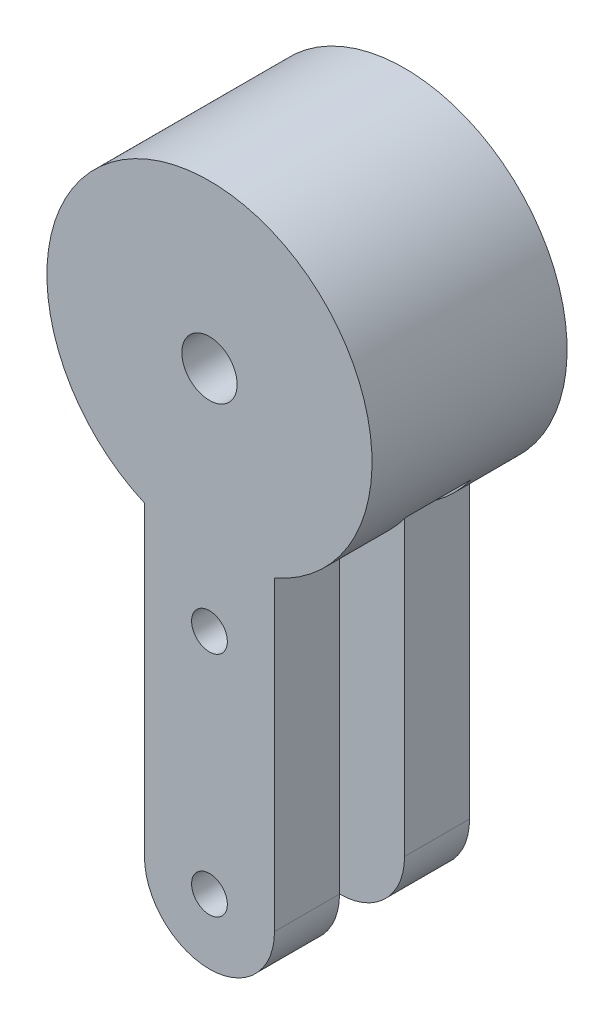
from build123d import *
from build123d.topology import SkipClean

# Parameters (mm, degrees)
SKETCH2_R           = 4.25
SKETCH2_R_2         = 2.75
BOSS_EXTRUDE1_DEPTH = 10
BOSS_EXTRUDE2_START = 10.4
BOSS_EXTRUDE2_DEPTH = 10.4
BOSS_EXTRUDE3_START = 10.4
SKETCH4_R           = 2.75
SKETCH4_R_2         = 4.25
BOSS_EXTRUDE3_DEPTH = 10.4
SKETCH5_R           = 4.25
BOSS_EXTRUDE4_DEPTH = 0.4
CUT_EXTRUDE2_DEPTH  = 0.4
CUT_EXTRUDE3_DEPTH  = 0.4


with BuildPart() as part:
    # Sketch2 → Boss-Extrude1 (new body)
    with BuildSketch(Plane.XY):
        with BuildLine():
            Line((-10, 237.087121525), (-10, 190))
            ThreePointArc((-10, 190), (0, 180), (10, 190))
            Line((10, 190), (10, 237.087121525))
            ThreePointArc((10, 237.087121525), (0, 285), (-10, 237.087121525))
        make_face()
        with Locations((0, 260)):
            Circle(SKETCH2_R, mode=Mode.SUBTRACT)
        with Locations((0, 225)):
            Circle(SKETCH2_R_2, mode=Mode.SUBTRACT)
        with Locations((0, 190)):
            Circle(SKETCH2_R_2, mode=Mode.SUBTRACT)
    extrude(amount=BOSS_EXTRUDE1_DEPTH)

    # Sketch3 → Boss-Extrude2 (add)
    with BuildSketch(Plane(origin=(0, 0, 0), x_dir=(-1, 0, 0), z_dir=(0, 0, -1)).offset(BOSS_EXTRUDE2_START)):
        with BuildLine():
            Line((-20.2, 245.270437888), (-20.2, 260))
            ThreePointArc((-20.2, 260), (0, 280.2), (20.2, 260))
            Line((20.2, 260), (20.2, 245.270437888))
            ThreePointArc((20.2, 245.270437888), (23.769728648, 252.254033308), (25, 260))
            ThreePointArc((25, 260), (-7.745966692, 283.769728648), (-20.2, 245.270437888))
        make_face()
    extrude(amount=-BOSS_EXTRUDE2_DEPTH)

    # Sketch4 → Boss-Extrude3 (add)
    with BuildSketch(Plane(origin=(0, 0, -10.4), x_dir=(-1, 0, 0), z_dir=(0, 0, -1)).offset(BOSS_EXTRUDE3_START)):
        with BuildLine():
            Line((-10, 237.087121525), (-10, 190))
            ThreePointArc((-10, 190), (0, 180), (10, 190))
            Line((10, 190), (10, 237.087121525))
            ThreePointArc((10, 237.087121525), (0, 285), (-10, 237.087121525))
        make_face()
        with Locations((0, 190)):
            Circle(SKETCH4_R, mode=Mode.SUBTRACT)
        with Locations((0, 225)):
            Circle(SKETCH4_R, mode=Mode.SUBTRACT)
        with Locations((0, 260)):
            Circle(SKETCH4_R_2, mode=Mode.SUBTRACT)
    extrude(amount=-BOSS_EXTRUDE3_DEPTH)

    # Sketch5 → Boss-Extrude4 (add)
    with SkipClean():  # the faces are left unmerged after this step: merging them gives an invalid solid
        with BuildSketch(Plane.XY.offset(-10.4)):
            with BuildLine():
                Line((-20.2, 260), (-20.2, 245.270437888))
                ThreePointArc((-20.2, 245.270437888), (-15.644541114, 240.500042735), (-10, 237.087121525))
                Line((-10, 237.087121525), (-10, 190))
                ThreePointArc((-10, 190), (0, 180), (10, 190))
                Line((10, 190), (10, 237.087121525))
                ThreePointArc((10, 237.087121525), (15.644541114, 240.500042735), (20.2, 245.270437888))
                Line((20.2, 245.270437888), (20.2, 260))
                ThreePointArc((20.2, 260), (0, 280.2), (-20.2, 260))
            make_face()
            with Locations((0, 260)):
                Circle(SKETCH5_R, mode=Mode.SUBTRACT)
        extrude(amount=BOSS_EXTRUDE4_DEPTH)
    add(part.part.scale(1), mode=Mode.REPLACE)  # the faces are merged on a copy

    # Sketch7 → Cut-Extrude2 (cut)
    with BuildSketch(Plane(origin=(0, 0, -20.8), x_dir=(-1, 0, 0), z_dir=(0, 0, -1))):
        with BuildLine():
            Line((-10, 237.087121525), (-10, 190))
            ThreePointArc((-10, 190), (0, 180), (10, 190))
            Line((10, 190), (10, 237.087121525))
            ThreePointArc((10, 237.087121525), (0, 285), (-10, 237.087121525))
        make_face()
    extrude(amount=-CUT_EXTRUDE2_DEPTH, mode=Mode.SUBTRACT)

    # Sketch8 → Cut-Extrude3 (cut)
    with BuildSketch(Plane(origin=(0, 0, -20.4), x_dir=(-1, 0, 0), z_dir=(0, 0, -1))):
        with BuildLine():
            Line((-10, 237.087121525), (-10, 190))
            ThreePointArc((-10, 190), (0, 180), (10, 190))
            Line((10, 190), (10, 237.087121525))
            ThreePointArc((10, 237.087121525), (0, 285), (-10, 237.087121525))
        make_face()
    extrude(amount=-CUT_EXTRUDE3_DEPTH, mode=Mode.SUBTRACT)


solid = part.part
